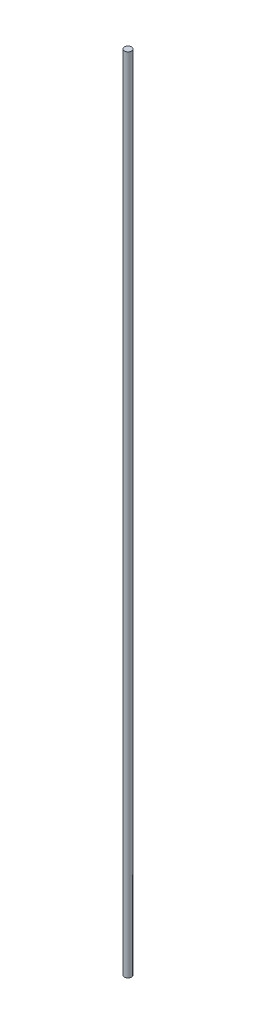
from build123d import *

# Parameters (mm, degrees)
SKETCH1_R           = 4.0005
BOSS_EXTRUDE1_DEPTH = 889


with BuildPart() as part:
    # Sketch1 → Boss-Extrude1 (new body)
    with BuildSketch(Plane(origin=(0, 0, 0), x_dir=(1, 0, 0), z_dir=(0, 1, 0))):
        with Locations(Location((0, 0, 0), (0, 0, 270))):
            Circle(SKETCH1_R)
    extrude(amount=BOSS_EXTRUDE1_DEPTH)


solid = part.part
